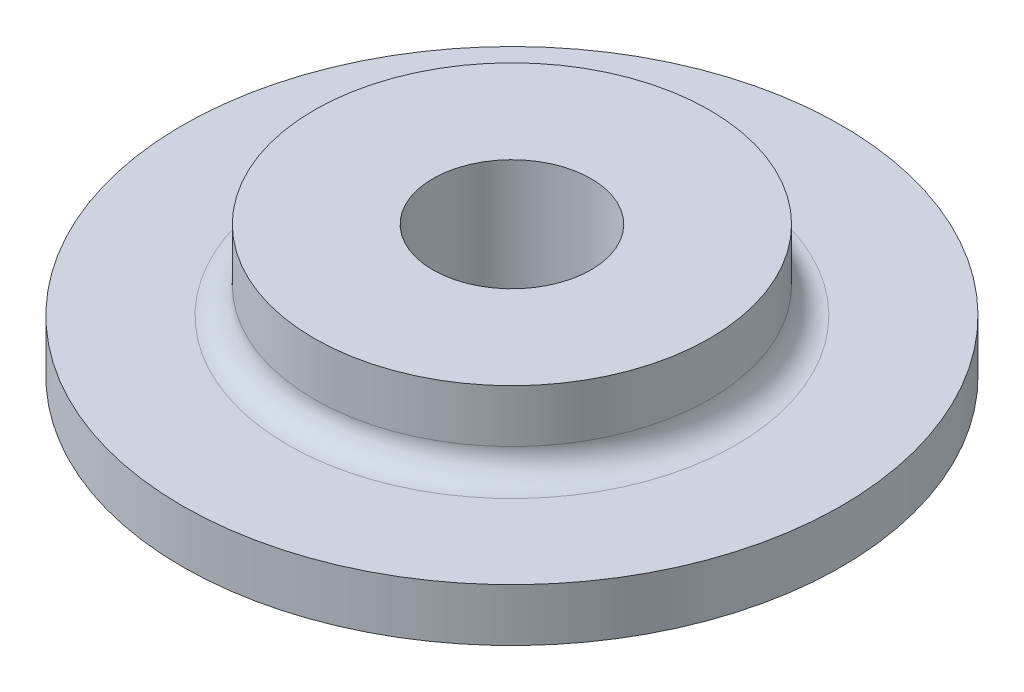
from build123d import *

# Parameters (mm, degrees)
SKETCH_1_R          = 12.5
EXTRUDE_1_DEPTH     = 2
SKETCH_2_R          = 7.5
EXTRUDE_2_DEPTH     = 3
FILLET_1_R          = 1
CUT_EXTRUDE_1_REACH = 20.371
SKETCH_3_R          = 3


with BuildPart() as part:
    # 草图1 → 凸台-拉伸1 (new body)
    with BuildSketch(Plane(origin=(0, 0, 0), x_dir=(1, 0, 0), z_dir=(0, 1, 0))):
        with Locations(Location((0, 0, 0), (0, 0, 270))):
            Circle(SKETCH_1_R)
    extrude(amount=EXTRUDE_1_DEPTH)

    # 草图2 → 凸台-拉伸2 (add)
    with BuildSketch(Plane(origin=(0, 2, 0), x_dir=(1, 0, 0), z_dir=(0, 1, 0))):
        with Locations(Location((0, 0, 0), (0, 0, 270))):
            Circle(SKETCH_2_R)
    extrude(amount=EXTRUDE_2_DEPTH)

    # 圆角1
    fillet_1_edges = [part.edges().sort_by_distance(p)[0] for p in [
        (0, 2, -7.5),
    ]]
    fillet(fillet_1_edges, radius=FILLET_1_R)

    # 草图3 → 切除-拉伸1 (cut, up to next)
    with BuildSketch(Plane(origin=(0, 5, 0), x_dir=(1, 0, 0), z_dir=(0, 1, 0)), mode=Mode.PRIVATE) as cut_extrude_1_sk1:
        with Locations(Location((0, 0, 0), (0, 0, 270))):
            Circle(SKETCH_3_R)
    cut_extrude_1_tool1 = extrude(cut_extrude_1_sk1.sketch, amount=-CUT_EXTRUDE_1_REACH, mode=Mode.PRIVATE) & part.part
    add(cut_extrude_1_tool1.solids().sort_by_distance((0, 5, 0))[0], mode=Mode.SUBTRACT)


solid = part.part
